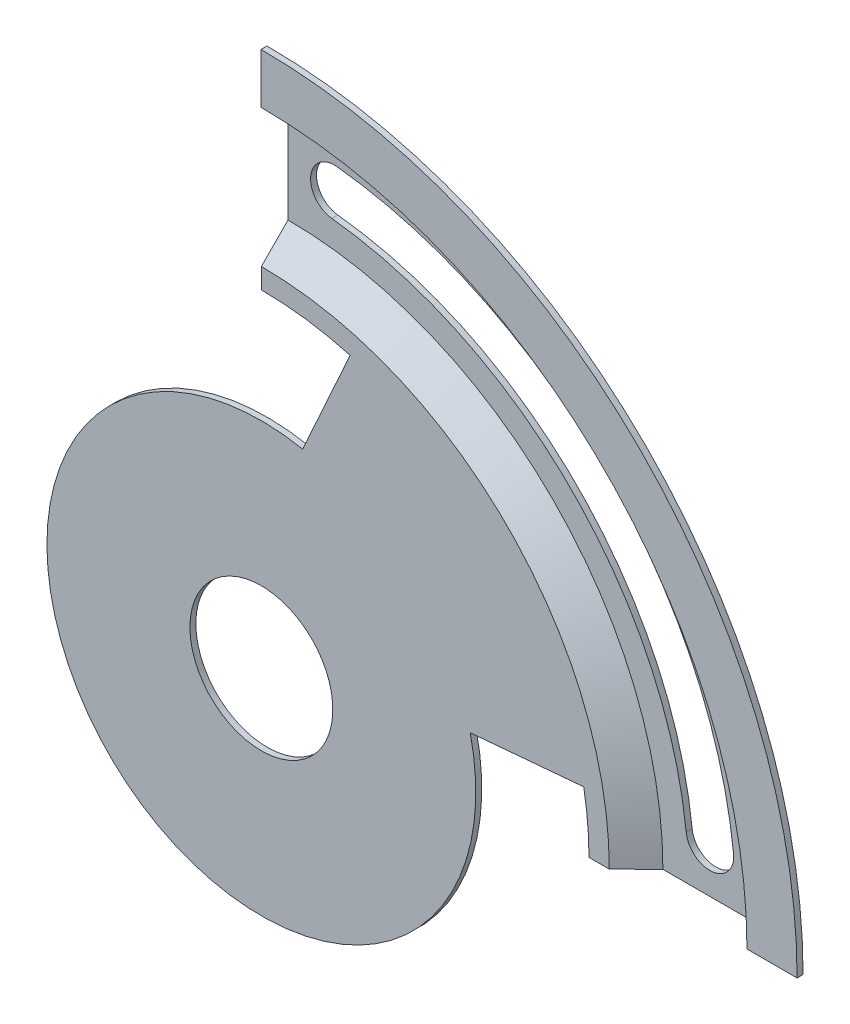
from build123d import *

# Parameters (mm, degrees)
REVOLVE1_ANGLE          = 90
BOSS_EXTRUDE1_START     = -1
SKETCH2_R               = 12
BOSS_EXTRUDE1_DEPTH     = 1
CUT_EXTRUDE1_DEPTH      = 143.444465377
CUT_EXTRUDE1_DEPTH_BACK = 143.444465377


with BuildPart() as part:
    # Sketch1 → Revolve1 (revolve)
    with BuildSketch(Plane(origin=(0, 0, 0), x_dir=(1, 0, 0), z_dir=(0, 1, 0))):
        Polygon((-16.271625609, -17.706954757), (-19.271625609, -17.706954757), (-19.271625609, -18.706954757), (-15.861337675, -18.706954757), (-11.331165057, -14.237179487), (2.840396891, -14.237179487), (7.310172161, -18.767352105), (15.728322279, -18.767352105), (15.728322279, -17.767352105), (7.728322279, -17.767352105), (3.258547009, -13.237179487), (-11.741452991, -13.237179487), align=None)
    revolve(axis=Axis((-74.271677721, 0, 17.706954757), (0, 0, 1)), revolution_arc=REVOLVE1_ANGLE)

    # Sketch2 → Boss-Extrude1 (add)
    with BuildSketch(Plane(origin=(0, 0, 17.706954757), x_dir=(-1, 0, 0), z_dir=(0, 0, -1)).offset(BOSS_EXTRUDE1_START)):
        with BuildLine():
            Line((67.342979074, 35.326946302), (59.371742963, 52.943344025))
            ThreePointArc((59.371742963, 52.943344025), (33.582268097, 37.005103388), (20.15595474, 9.823149116))
            Line((20.15595474, 9.823149116), (39.208104561, 8.157563191))
            ThreePointArc((39.208104561, 8.157563191), (99.279307908, -25.89630152), (67.342979074, 35.326946302))
        make_face()
        with Locations((74.271677721, 0)):
            Circle(SKETCH2_R, mode=Mode.SUBTRACT)
    extrude(amount=BOSS_EXTRUDE1_DEPTH)

    # Sketch3 → Cut-Extrude1 (cut, two sides: drawn at the far end of the back side and taken through both)
    with BuildSketch(Plane(origin=(0, 0, 13.237179487), x_dir=(-1, 0, 0), z_dir=(0, 0, -1)).offset(-CUT_EXTRUDE1_DEPTH_BACK)):
        with BuildLine():
            ThreePointArc((7.421193768, 7.350328837), (3.090443615, 3.801635214), (-0.54921214, 8.056224419))
            ThreePointArc((-0.54921214, 8.056224419), (21.059515993, 53.212161728), (66.215453303, 74.820889862))
            ThreePointArc((66.215453303, 74.820889862), (70.470042507, 71.181234106), (66.921348884, 66.850483953))
            ThreePointArc((66.921348884, 66.850483953), (26.716370243, 47.555307479), (7.421193768, 7.350328837))
        make_face()
    extrude(amount=CUT_EXTRUDE1_DEPTH + CUT_EXTRUDE1_DEPTH_BACK, mode=Mode.SUBTRACT)


solid = part.part
